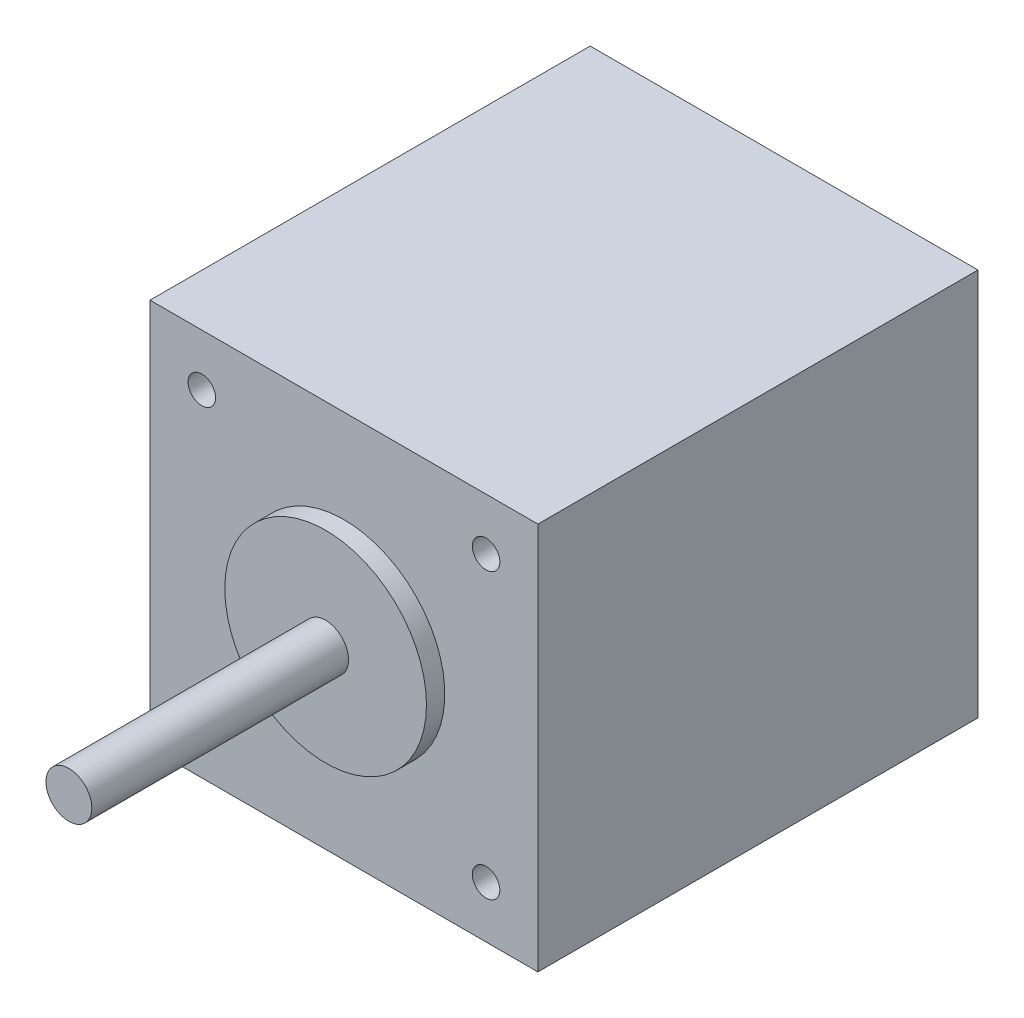
from build123d import *

# Parameters (mm, degrees)
SKETCH_1_W          = 42.3
SKETCH_1_H          = 42.3
EXTRUDE_1492_DEPTH  = 48
SKETCH_2_R          = 2.5
EXTRUDE_1547_DEPTH  = 78
SKETCH_3_R          = 11
EXTRUDE_1594_DEPTH  = 50
CUT_EXTRUDE_START   = 48
SKETCH_5_R          = 1.5
CUT_EXTRUDE_3_DEPTH = 4.5


with BuildPart() as part:
    # Эскиз1 → Extrude 1492 (new body)
    with BuildSketch(Plane.XY):
        Rectangle(SKETCH_1_W, SKETCH_1_H)
    extrude(amount=EXTRUDE_1492_DEPTH)

    # Эскиз2 → Extrude 1547 (add)
    with BuildSketch(Plane.XY):
        with Locations(Location((0, 0, 0), (0, 0, 180))):
            Circle(SKETCH_2_R)
    extrude(amount=EXTRUDE_1547_DEPTH)

    # Эскиз3 → Extrude 1594 (add)
    with BuildSketch(Plane.XY):
        with Locations(Location((0, 0, 0), (0, 0, 180))):
            Circle(SKETCH_3_R)
    extrude(amount=EXTRUDE_1594_DEPTH)

    # Эскиз5 → Крепеж_М3_ПРЕДВ (cut)
    with BuildSketch(Plane.XY.offset(CUT_EXTRUDE_START)):
        with Locations((-15.5, -15.5)):
            Circle(SKETCH_5_R)
        with Locations((-15.5, 15.5)):
            Circle(SKETCH_5_R)
        with Locations((15.5, -15.5)):
            Circle(SKETCH_5_R)
        with Locations((15.5, 15.5)):
            Circle(SKETCH_5_R)
    extrude(amount=-CUT_EXTRUDE_3_DEPTH, mode=Mode.SUBTRACT)


solid = part.part
